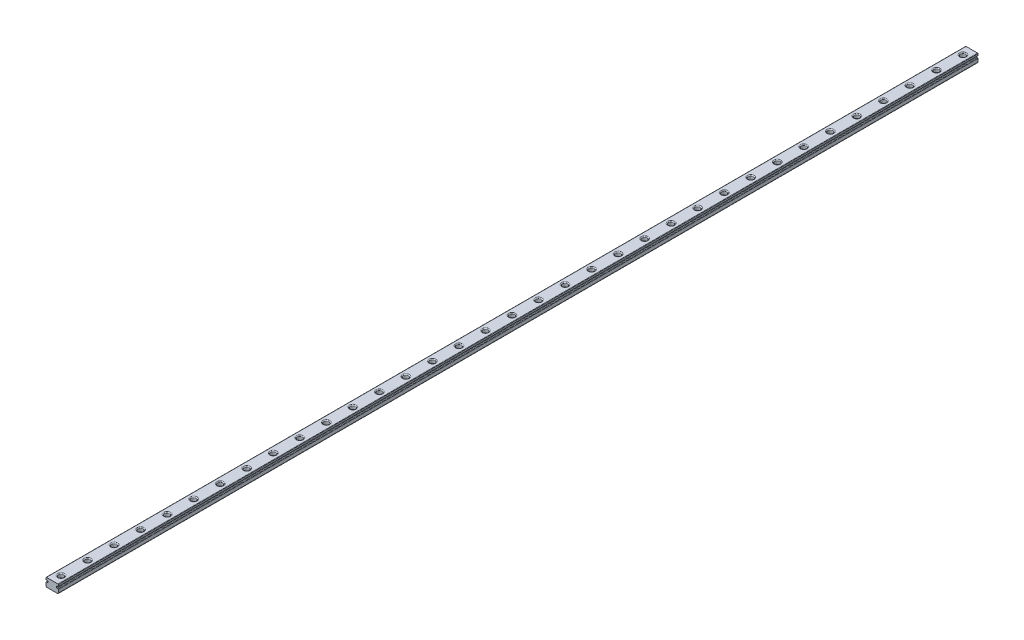
from build123d import *

# Parameters (mm, degrees)
EXTRUDE_1_DEPTH                = 550
FILLET_1_R                     = 0.25
FILLET_2_R                     = 0.5
SKETCH_2_R                     = 1.5
CUT_EXTRUDE_1_DEPTH            = 2.3
SKETCH_3_R                     = 1.2
CUT_EXTRUDE_2_DEPTH            = 551.05022498
FILLET_3_R                     = 0.5
PATTERN_LINEAR_2_COUNT         = 37
PATTERN_LINEAR_2_PITCH         = 15
FILLET_3_OF_PATTERN_LINEAR_2_R = 0.5
SKETCH_4_W                     = 7.607362056
SKETCH_4_H                     = 5.534224128
CUT_EXTRUDE_3_DEPTH            = 30


with BuildPart() as part:
    # 草图1 → 凸台-拉伸1 (new body)
    with BuildSketch(Plane.XY):
        Polygon((7, 2.5), (7, 0), (0, 0), (0, 2.5), (1, 2.5), (1, 3.5), (0, 3.5), (0, 4.8), (7, 4.8), (7, 3.5), (6, 3.5), (6, 2.5), align=None)
    extrude(amount=EXTRUDE_1_DEPTH)

    # 圆角1
    fillet_1_edges = [part.edges().sort_by_distance(p)[0] for p in [
        (0, 2.5, 275),
        (1, 2.5, 275),
        (1, 3.5, 275),
        (0, 3.5, 275),
        (0, 4.8, 275),
        (7, 4.8, 275),
        (7, 3.5, 275),
        (6, 3.5, 275),
        (6, 2.5, 275),
        (7, 2.5, 275),
    ]]
    fillet(fillet_1_edges, radius=FILLET_1_R)

    # 圆角2
    fillet_2_edges = [part.edges().sort_by_distance(p)[0] for p in [
        (7, 0, 275),
        (0, 0, 275),
    ]]
    fillet(fillet_2_edges, radius=FILLET_2_R)

    # 草图2 → 切除-拉伸1 (cut)
    with BuildSketch(Plane(origin=(0, 4.8, 0), x_dir=(1, 0, 0), z_dir=(0, 1, 0))):
        with Locations(Location((3.5, -5, 0), (0, 0, 270))):
            Circle(SKETCH_2_R)
    cut_extrude_1 = extrude(amount=-CUT_EXTRUDE_1_DEPTH, mode=Mode.SUBTRACT)

    # 草图3 → 切除-拉伸2 (cut, through all)
    with BuildSketch(Plane(origin=(0, 2.5, 0), x_dir=(1, 0, 0), z_dir=(0, 1, 0))):
        with Locations(Location((3.5, -5, 0), (0, 0, 270))):
            Circle(SKETCH_3_R)
    cut_extrude_2 = extrude(amount=-CUT_EXTRUDE_2_DEPTH, mode=Mode.SUBTRACT)

    # 圆角3
    fillet_3_edges = [part.edges().sort_by_distance(p)[0] for p in [
        (3.5, 4.8, 3.5),
    ]]
    fillet(fillet_3_edges, radius=FILLET_3_R)

    # 阵列(线性)2: 切除-拉伸1, 切除-拉伸2 ×37
    with Locations(*[(0, 0, i * PATTERN_LINEAR_2_PITCH) for i in range(1, PATTERN_LINEAR_2_COUNT)]):
        add(cut_extrude_1, mode=Mode.SUBTRACT)
        add(cut_extrude_2, mode=Mode.SUBTRACT)

    # 圆角3 of 阵列(线性)2
    fillet_3_of_pattern_linear_2_edges = [part.edges().sort_by_distance(p)[0] for p in [
        (3.5, 4.8, 18.5),
        (3.5, 4.8, 33.5),
        (3.5, 4.8, 48.5),
        (3.5, 4.8, 63.5),
        (3.5, 4.8, 78.5),
        (3.5, 4.8, 93.5),
        (3.5, 4.8, 108.5),
        (3.5, 4.8, 123.5),
        (3.5, 4.8, 138.5),
        (3.5, 4.8, 153.5),
        (3.5, 4.8, 168.5),
        (3.5, 4.8, 183.5),
        (3.5, 4.8, 198.5),
        (3.5, 4.8, 213.5),
        (3.5, 4.8, 228.5),
        (3.5, 4.8, 243.5),
        (3.5, 4.8, 258.5),
        (3.5, 4.8, 273.5),
        (3.5, 4.8, 288.5),
        (3.5, 4.8, 303.5),
        (3.5, 4.8, 318.5),
        (3.5, 4.8, 333.5),
        (3.5, 4.8, 348.5),
        (3.5, 4.8, 363.5),
        (3.5, 4.8, 378.5),
        (3.5, 4.8, 393.5),
        (3.5, 4.8, 408.5),
        (3.5, 4.8, 423.5),
        (3.5, 4.8, 438.5),
        (3.5, 4.8, 453.5),
        (3.5, 4.8, 468.5),
        (3.5, 4.8, 483.5),
        (3.5, 4.8, 498.5),
        (3.5, 4.8, 513.5),
        (3.5, 4.8, 528.5),
        (3.5, 4.8, 543.5),
    ]]
    fillet(fillet_3_of_pattern_linear_2_edges, radius=FILLET_3_OF_PATTERN_LINEAR_2_R)

    # 草图4 → 切除-拉伸3 (cut)
    with BuildSketch(Plane.XY.offset(550)):
        with Locations((3.651776821, 2.327683724)):
            Rectangle(SKETCH_4_W, SKETCH_4_H)
    extrude(amount=-CUT_EXTRUDE_3_DEPTH, mode=Mode.SUBTRACT)


solid = part.part
